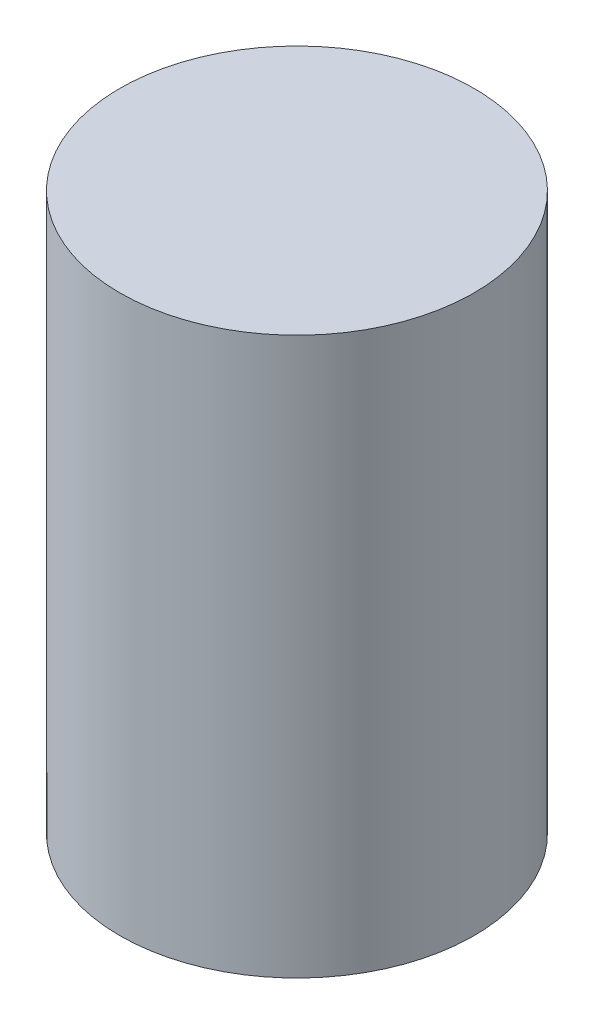
from build123d import *

# Parameters (mm, degrees)
SKETCH1_R           = 17.5
BOSS_EXTRUDE1_DEPTH = 55


with BuildPart() as part:
    # Sketch1 → Boss-Extrude1 (new body)
    with BuildSketch(Plane(origin=(0, 0, 0), x_dir=(1, 0, 0), z_dir=(0, 1, 0))):
        Circle(SKETCH1_R)
    extrude(amount=BOSS_EXTRUDE1_DEPTH)


solid = part.part
